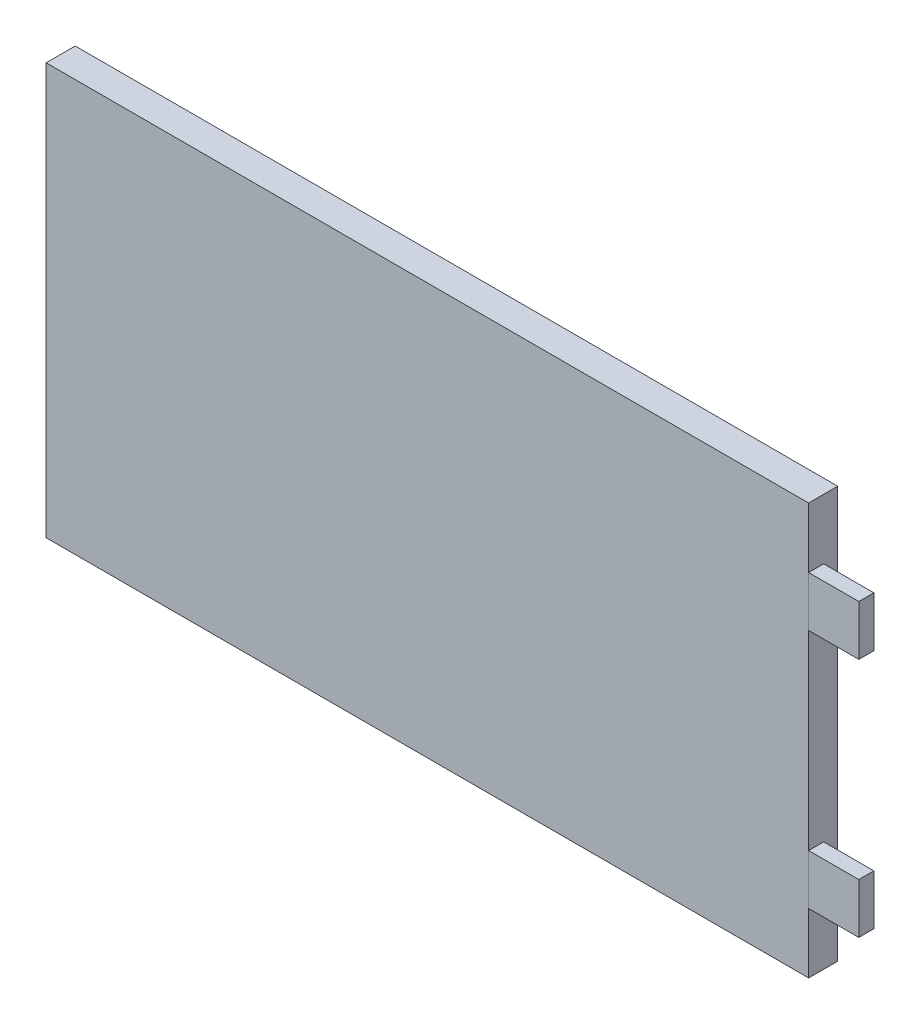
from build123d import *

# Parameters (mm, degrees)
SKETCH_1_W        = 76
SKETCH_1_H        = 41
EXTRUDE_1_DEPTH   = 2.9
SKETCH_2_W        = 5
SKETCH_2_H        = 5
EXTRUDE_2_DEPTH   = 1.5
EXTRUDE_2_2_DEPTH = 1.5


with BuildPart() as part:
    # 草图1 → 凸台-拉伸1 (new body)
    with BuildSketch(Plane.XY):
        Rectangle(SKETCH_1_W, SKETCH_1_H)
    extrude(amount=EXTRUDE_1_DEPTH)


with BuildPart() as body_2:
    # 草图2 → 凸台-拉伸2 (new body)
    with BuildSketch(Plane.XY.offset(2.9)):
        with Locations((40.5, 12)):
            Rectangle(SKETCH_2_W, SKETCH_2_H)
    extrude(amount=-EXTRUDE_2_DEPTH)


with BuildPart() as body_3:
    # 草图2 → Extrude 2 2 (new body)
    with BuildSketch(Plane.XY.offset(2.9)):
        with Locations((40.5, -12)):
            Rectangle(SKETCH_2_W, SKETCH_2_H)
    extrude(amount=-EXTRUDE_2_2_DEPTH)


solid = Compound([part.part, body_2.part, body_3.part])
